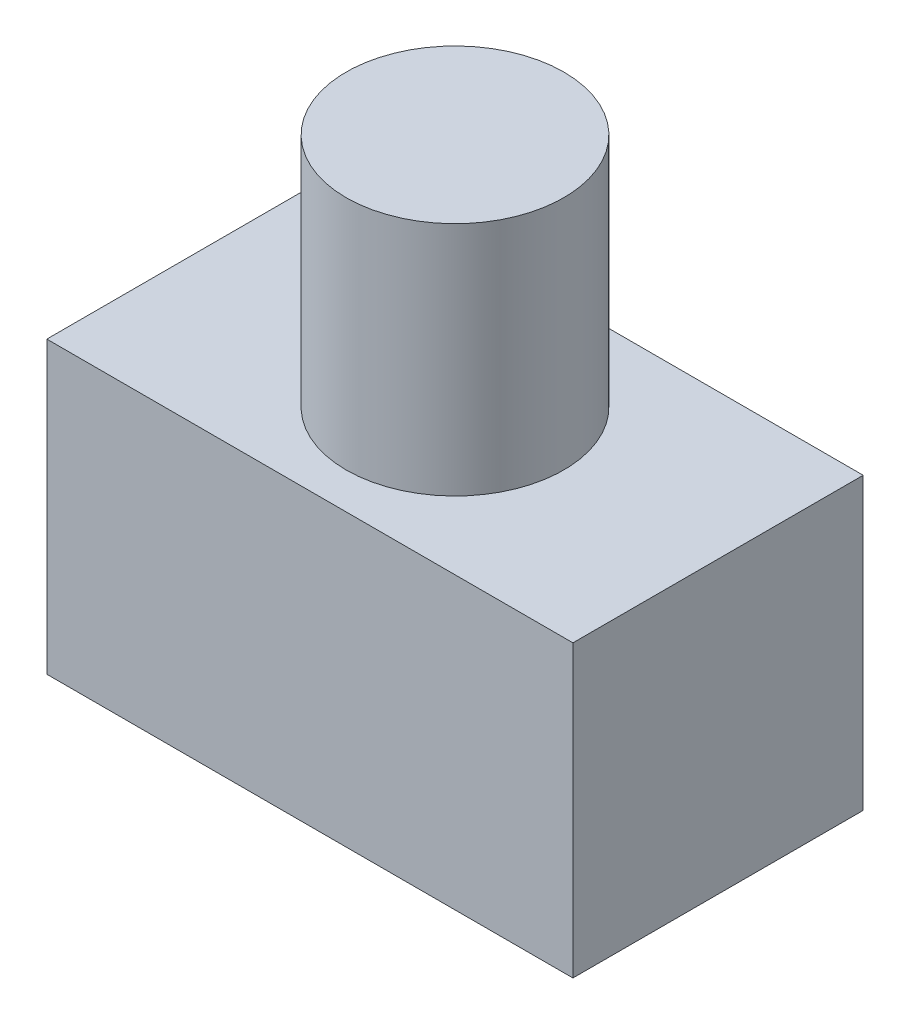
from build123d import *

# Parameters (mm, degrees)
SKETCH1_W           = 29
SKETCH1_H           = 16
BOSS_EXTRUDE1_DEPTH = 16
SKETCH2_R           = 6
BOSS_EXTRUDE2_DEPTH = 13


with BuildPart() as part:
    # Sketch1 → Boss-Extrude1 (new body)
    with BuildSketch(Plane(origin=(0, 0, 0), x_dir=(1, 0, 0), z_dir=(0, 1, 0))):
        Rectangle(SKETCH1_W, SKETCH1_H)
    extrude(amount=BOSS_EXTRUDE1_DEPTH)

    # Sketch2 → Boss-Extrude2 (add)
    with BuildSketch(Plane(origin=(0, 16, 0), x_dir=(1, 0, 0), z_dir=(0, 1, 0))):
        with Locations(Location((0, 0, 0), (0, 0, 90))):
            Circle(SKETCH2_R)
    extrude(amount=BOSS_EXTRUDE2_DEPTH)


solid = part.part
